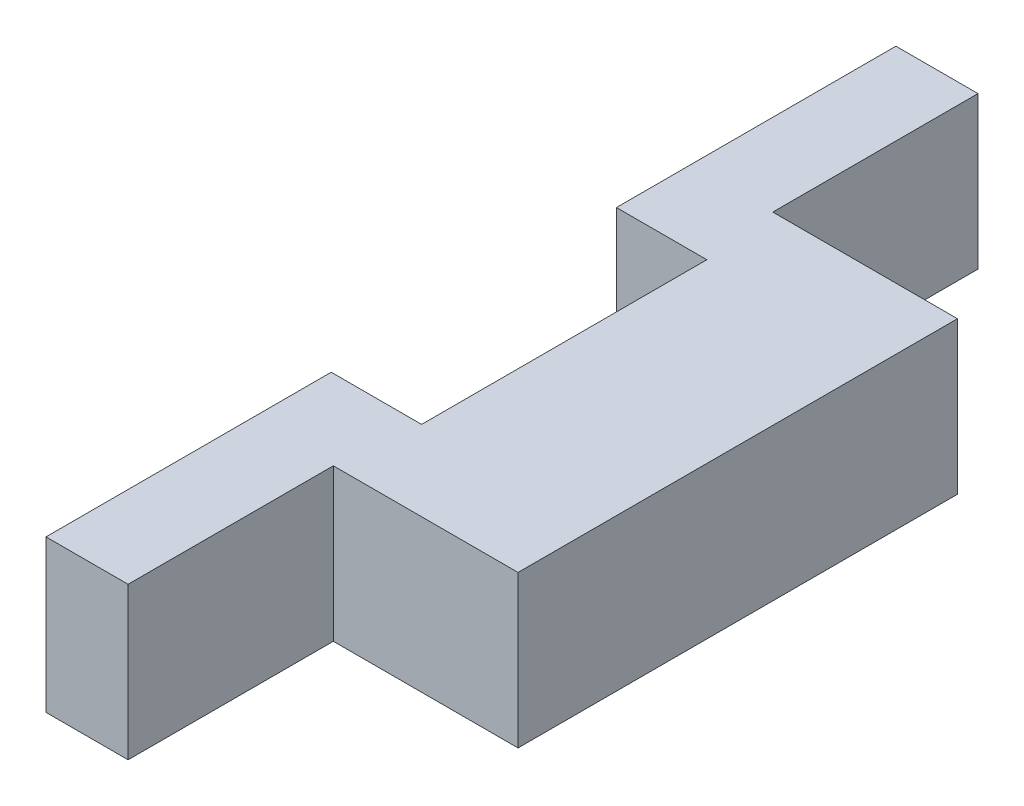
from build123d import *

# Parameters (mm, degrees)
SKETCH1_W               = 27.191844216
SKETCH1_H               = 9.407407408
BOSS_EXTRUDE1_DEPTH     = 16.51
SKETCH1_3_W             = 12.7
SKETCH1_3_H             = 9.407407408
BOSS_EXTRUDE2_DEPTH     = 5.08
CUT_EXTRUDE1_DEPTH      = 20.828
CUT_EXTRUDE1_DEPTH_BACK = 20.828
SKETCH2_W               = 5.594013652
SKETCH2_H               = 17.651209439


with BuildPart() as part:
    # Sketch1 → Boss-Extrude1 (new body)
    with BuildSketch(Plane(origin=(0, 0, 0), x_dir=(0, 0, -1), z_dir=(1, 0, 0))):
        with Locations((-11.239440409, 3.175)):
            Rectangle(SKETCH1_W, SKETCH1_H)
    extrude(amount=BOSS_EXTRUDE1_DEPTH)

    # Sketch1<3> → Boss-Extrude2 (add)
    with BuildSketch(Plane(origin=(0, 0, 0), x_dir=(0, 0, -1), z_dir=(1, 0, 0))):
        with Locations((-31.185362517, 3.175)):
            Rectangle(SKETCH1_3_W, SKETCH1_3_H)
        with Locations((8.706481699, 3.175)):
            Rectangle(SKETCH1_3_W, SKETCH1_3_H)
    extrude(amount=BOSS_EXTRUDE2_DEPTH)

    # Sketch2 → Cut-Extrude1 (cut, two sides: drawn at the far end of the back side and taken through both)
    with BuildSketch(Plane(origin=(0, 0, 0), x_dir=(1, 0, 0), z_dir=(0, 1, 0)).offset(-CUT_EXTRUDE1_DEPTH_BACK)):
        with Locations((2.797006826, -11.06204132)):
            Rectangle(SKETCH2_W, SKETCH2_H)
    extrude(amount=CUT_EXTRUDE1_DEPTH + CUT_EXTRUDE1_DEPTH_BACK, mode=Mode.SUBTRACT)


solid = part.part
